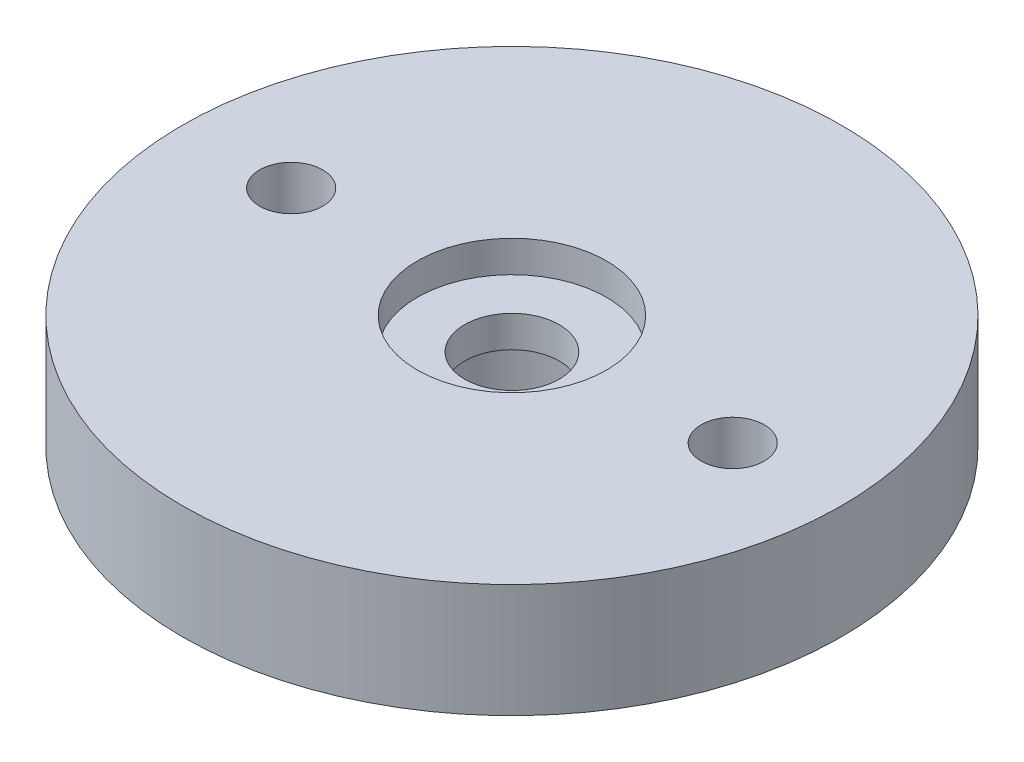
from build123d import *

# Parameters (mm, degrees)
CROQUIS1_R              = 10.45
CROQUIS1_R_2            = 4.25
SALIENTE_EXTRUIR1_DEPTH = 3.6
CROQUIS1_3_R            = 4.25
CROQUIS1_3_R_2          = 3
SALIENTE_EXTRUIR2_DEPTH = 6
CORTAR_EXTRUIR1_REACH   = 17.95
CROQUIS3_R              = 1
SALIENTE_EXTRUIR3_START = -1
CROQUIS4_R              = 3
SALIENTE_EXTRUIR3_DEPTH = 1
CROQUIS5_R              = 1.5
CORTAR_EXTRUIR2_DEPTH   = 1


with BuildPart() as part:
    # Croquis1 → Saliente-Extruir1 (new body)
    with BuildSketch(Plane(origin=(0, 0, 0), x_dir=(1, 0, 0), z_dir=(0, 1, 0))):
        with Locations(Location((0, 0, 0), (0, 0, 270))):
            Circle(CROQUIS1_R)
        with Locations(Location((0, 0, 0), (0, 0, 270))):
            Circle(CROQUIS1_R_2, mode=Mode.SUBTRACT)
    extrude(amount=-SALIENTE_EXTRUIR1_DEPTH)

    # Croquis1<3> → Saliente-Extruir2 (add)
    with BuildSketch(Plane(origin=(0, 0, 0), x_dir=(1, 0, 0), z_dir=(0, 1, 0))):
        with Locations(Location((0, 0, 0), (0, 0, 270))):
            Circle(CROQUIS1_3_R)
        with Locations(Location((0, 0, 0), (0, 0, 270))):
            Circle(CROQUIS1_3_R_2, mode=Mode.SUBTRACT)
    extrude(amount=-SALIENTE_EXTRUIR2_DEPTH)

    # Croquis3 → Cortar-Extruir1 (cut, up to next)
    with BuildSketch(Plane(origin=(0, 0, 0), x_dir=(1, 0, 0), z_dir=(0, 1, 0)), mode=Mode.PRIVATE) as cortar_extruir1_sk1:
        with Locations(Location((7, 0, 0), (0, 0, 270))):
            Circle(CROQUIS3_R)
    cortar_extruir1_tool1 = extrude(cortar_extruir1_sk1.sketch, amount=-CORTAR_EXTRUIR1_REACH, mode=Mode.PRIVATE) & part.part
    # Croquis3 → Cortar-Extruir1 (cut, up to next)
    with BuildSketch(Plane(origin=(0, 0, 0), x_dir=(1, 0, 0), z_dir=(0, 1, 0)), mode=Mode.PRIVATE) as cortar_extruir1_sk2:
        with Locations(Location((-7, 0, 0), (0, 0, 270))):
            Circle(CROQUIS3_R)
    cortar_extruir1_tool2 = extrude(cortar_extruir1_sk2.sketch, amount=-CORTAR_EXTRUIR1_REACH, mode=Mode.PRIVATE) & part.part
    add(cortar_extruir1_tool1.solids().sort_by_distance((7, 0, 0))[0], mode=Mode.SUBTRACT)
    add(cortar_extruir1_tool2.solids().sort_by_distance((-7, 0, 0))[0], mode=Mode.SUBTRACT)

    # Croquis4 → Saliente-Extruir3 (add)
    with BuildSketch(Plane(origin=(0, 0, 0), x_dir=(1, 0, 0), z_dir=(0, 1, 0)).offset(SALIENTE_EXTRUIR3_START)):
        with Locations(Location((0, 0, 0), (0, 0, 270))):
            Circle(CROQUIS4_R)
    extrude(amount=-SALIENTE_EXTRUIR3_DEPTH)

    # Croquis5 → Cortar-Extruir2 (cut)
    with BuildSketch(Plane(origin=(0, -1, 0), x_dir=(1, 0, 0), z_dir=(0, 1, 0))):
        with Locations(Location((0, 0, 0), (0, 0, 270))):
            Circle(CROQUIS5_R)
    extrude(amount=-CORTAR_EXTRUIR2_DEPTH, mode=Mode.SUBTRACT)


solid = part.part
